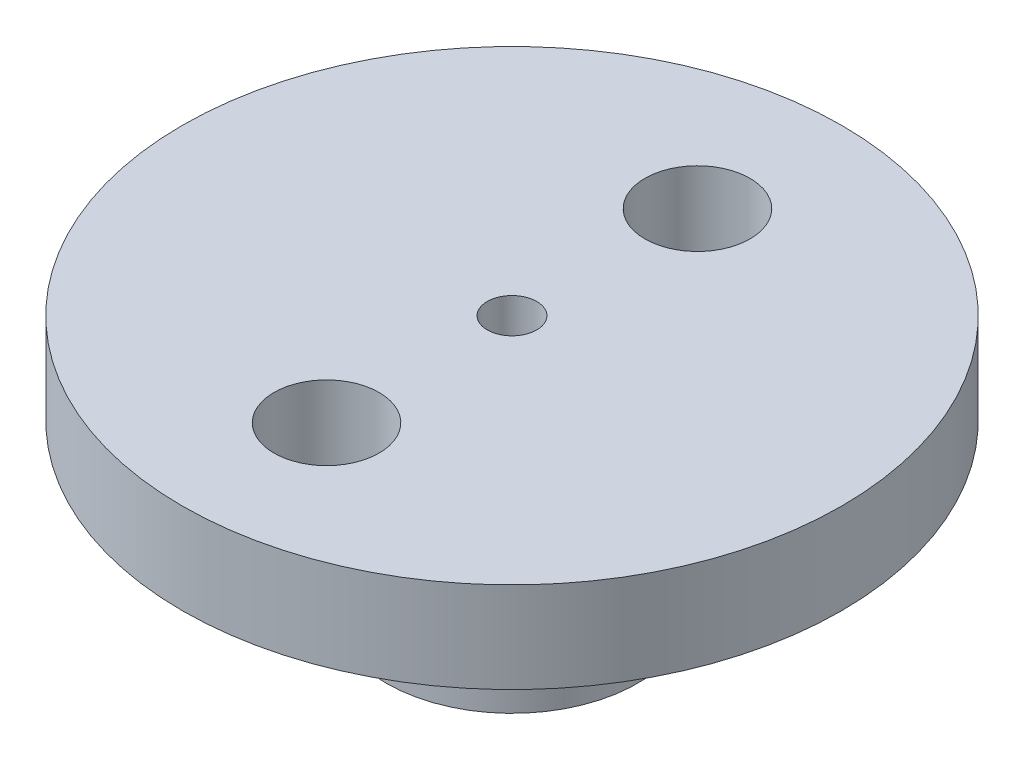
from build123d import *

# Parameters (mm, degrees)
SKETCH1_R           = 8
BOSS_EXTRUDE1_DEPTH = 2.2
SKETCH2_R           = 1.275
CUT_EXTRUDE1_DEPTH  = 2.2
SKETCH3_R           = 3.05
SKETCH3_R_2         = 2.3
BOSS_EXTRUDE2_DEPTH = 4
SKETCH8_R           = 0.6
CUT_EXTRUDE7_DEPTH  = 2.2


with BuildPart() as part:
    # Sketch1 → Boss-Extrude1 (new body)
    with BuildSketch(Plane(origin=(0, 0, 0), x_dir=(1, 0, 0), z_dir=(0, 1, 0))):
        with Locations(Location((0, 0, 0), (0, 0, 270))):
            Circle(SKETCH1_R)
    extrude(amount=BOSS_EXTRUDE1_DEPTH)

    # Sketch2 → Cut-Extrude1 (cut)
    with BuildSketch(Plane(origin=(0, 2.2, 0), x_dir=(1, 0, 0), z_dir=(0, 1, 0))):
        with Locations(Location((0, 4.5, 0), (0, 0, 270))):
            Circle(SKETCH2_R)
        with Locations(Location((0, -4.5, 0), (0, 0, 90))):
            Circle(SKETCH2_R)
    extrude(amount=-CUT_EXTRUDE1_DEPTH, mode=Mode.SUBTRACT)

    # Sketch3 → Boss-Extrude2 (add)
    with BuildSketch(Plane.XZ):
        with Locations(Location((0, 0, 0), (0, 0, 90))):
            Circle(SKETCH3_R)
        with Locations(Location((0, 0, 0), (0, 0, 270))):
            Circle(SKETCH3_R_2, mode=Mode.SUBTRACT)
    extrude(amount=BOSS_EXTRUDE2_DEPTH)

    # Sketch8 → Cut-Extrude7 (cut)
    with BuildSketch(Plane.XZ):
        with Locations(Location((0, 0, 0), (0, 0, 270))):
            Circle(SKETCH8_R)
    extrude(amount=-CUT_EXTRUDE7_DEPTH, mode=Mode.SUBTRACT)


solid = part.part
